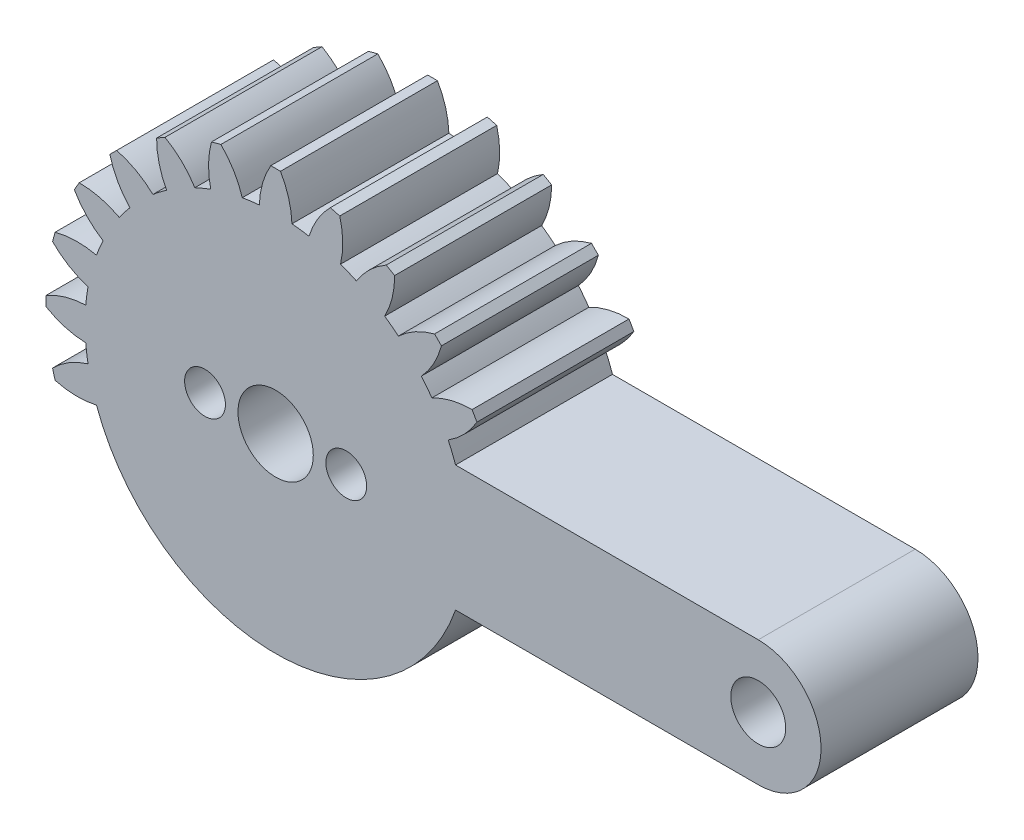
from build123d import *

# Parameters (mm, degrees)
SKETCH1_R           = 1.75
BOSS_EXTRUDE1_DEPTH = 10
SKETCH2_R           = 2.4
SKETCH2_R_2         = 1.3
CUT_EXTRUDE1_DEPTH  = 40.007683858


with BuildPart() as part:
    # Sketch1 → Boss-Extrude1 (new body)
    with BuildSketch(Plane.XY):
        with BuildLine():
            Line((0.31, 14.63), (-0.31, 14.63))
            ThreePointArc((-0.31, 14.63), (-0.832135832, 13.407942292), (-1.04, 12.095371015))
            ThreePointArc((-1.04, 12.095371015), (-1.584587974, 12.036140617), (-2.125949517, 11.952403049))
            ThreePointArc((-2.125949517, 11.952403049), (-2.66644933, 13.166450339), (-3.487085624, 14.211728743))
            Line((-3.487085624, 14.211728743), (-4.085959636, 14.051260935))
            ThreePointArc((-4.085959636, 14.051260935), (-4.274012312, 12.735705136), (-4.135075236, 11.414059435))
            ThreePointArc((-4.135075236, 11.414059435), (-4.645776869, 11.215897525), (-5.147019088, 10.994898568))
            ThreePointArc((-5.147019088, 10.994898568), (-5.983320376, 12.027686554), (-7.046532125, 12.824951657))
            Line((-7.046532125, 12.824951657), (-7.583467875, 12.514951657))
            ThreePointArc((-7.583467875, 12.514951657), (-7.424621916, 11.195550721), (-6.948351928, 9.954898568))
            ThreePointArc((-6.948351928, 9.954898568), (-7.390363748, 9.631309551), (-7.817327814, 9.288109918))
            ThreePointArc((-7.817327814, 9.288109918), (-8.892438027, 10.069255806), (-10.125769107, 10.564175311))
            Line((-10.125769107, 10.564175311), (-10.564175311, 10.125769107))
            ThreePointArc((-10.564175311, 10.125769107), (-10.069255806, 8.892438027), (-9.288109918, 7.817327814))
            ThreePointArc((-9.288109918, 7.817327814), (-9.631309551, 7.390363748), (-9.954898568, 6.948351928))
            ThreePointArc((-9.954898568, 6.948351928), (-11.195550721, 7.424621916), (-12.514951657, 7.583467875))
            Line((-12.514951657, 7.583467875), (-12.824951657, 7.046532125))
            ThreePointArc((-12.824951657, 7.046532125), (-12.027686554, 5.983320376), (-10.994898568, 5.147019088))
            ThreePointArc((-10.994898568, 5.147019088), (-11.215897525, 4.645776869), (-11.414059435, 4.135075236))
            ThreePointArc((-11.414059435, 4.135075236), (-12.735705136, 4.274012312), (-14.051260935, 4.085959636))
            Line((-14.051260935, 4.085959636), (-14.211728743, 3.487085624))
            ThreePointArc((-14.211728743, 3.487085624), (-13.166450339, 2.66644933), (-11.952403049, 2.125949517))
            ThreePointArc((-11.952403049, 2.125949517), (-12.036140617, 1.584587974), (-12.095371015, 1.04))
            ThreePointArc((-12.095371015, 1.04), (-13.407942292, 0.832135832), (-14.63, 0.31))
            Line((-14.63, 0.31), (-14.63, -0.31))
            ThreePointArc((-14.63, -0.31), (-13.407942292, -0.832135832), (-12.095371015, -1.04))
            ThreePointArc((-12.095371015, -1.04), (-12.036140617, -1.584587974), (-11.952403049, -2.125949517))
            ThreePointArc((-11.952403049, -2.125949517), (-13.166450339, -2.66644933), (-14.211728743, -3.487085624))
            Line((-14.211728743, -3.487085624), (-14.051260935, -4.085959636))
            ThreePointArc((-14.051260935, -4.085959636), (-12.735705136, -4.274012312), (-11.414059435, -4.135075236))
            ThreePointArc((-11.414059435, -4.135075236), (0.071680966, -12.139788377), (11.46209405, -4))
            Line((11.46209405, -4), (30.75, -4))
            ThreePointArc((30.75, -4), (34.75, 0), (30.75, 4))
            Line((30.75, 4), (11.46209405, 4))
            ThreePointArc((11.46209405, 4), (11.243133129, 4.579471307), (10.994898568, 5.147019088))
            ThreePointArc((10.994898568, 5.147019088), (12.027686554, 5.983320376), (12.824951657, 7.046532125))
            Line((12.824951657, 7.046532125), (12.514951657, 7.583467875))
            ThreePointArc((12.514951657, 7.583467875), (11.195550721, 7.424621916), (9.954898568, 6.948351928))
            ThreePointArc((9.954898568, 6.948351928), (9.631309551, 7.390363748), (9.288109918, 7.817327814))
            ThreePointArc((9.288109918, 7.817327814), (10.069255806, 8.892438027), (10.564175311, 10.125769107))
            Line((10.564175311, 10.125769107), (10.125769107, 10.564175311))
            ThreePointArc((10.125769107, 10.564175311), (8.892438027, 10.069255806), (7.817327814, 9.288109918))
            ThreePointArc((7.817327814, 9.288109918), (7.390363748, 9.631309551), (6.948351928, 9.954898568))
            ThreePointArc((6.948351928, 9.954898568), (7.424621916, 11.195550721), (7.583467875, 12.514951657))
            Line((7.583467875, 12.514951657), (7.046532125, 12.824951657))
            ThreePointArc((7.046532125, 12.824951657), (5.983320376, 12.027686554), (5.147019088, 10.994898568))
            ThreePointArc((5.147019088, 10.994898568), (4.645776869, 11.215897525), (4.135075236, 11.414059435))
            ThreePointArc((4.135075236, 11.414059435), (4.274012312, 12.735705136), (4.085959636, 14.051260935))
            Line((4.085959636, 14.051260935), (3.487085624, 14.211728743))
            ThreePointArc((3.487085624, 14.211728743), (2.66644933, 13.166450339), (2.125949517, 11.952403049))
            ThreePointArc((2.125949517, 11.952403049), (1.584587974, 12.036140617), (1.04, 12.095371015))
            ThreePointArc((1.04, 12.095371015), (0.832135832, 13.407942292), (0.31, 14.63))
        make_face()
        Circle(SKETCH1_R, mode=Mode.SUBTRACT)
        with Locations((30.75, 0)):
            Circle(SKETCH1_R, mode=Mode.SUBTRACT)
    extrude(amount=BOSS_EXTRUDE1_DEPTH)

    # Sketch2 → Cut-Extrude1 (cut, through all)
    with BuildSketch(Plane.XY.offset(10)):
        Circle(SKETCH2_R)
        with Locations((-4.5, 0)):
            Circle(SKETCH2_R_2)
        with Locations((4.5, 0)):
            Circle(SKETCH2_R_2)
    extrude(amount=-CUT_EXTRUDE1_DEPTH, mode=Mode.SUBTRACT)


solid = part.part
